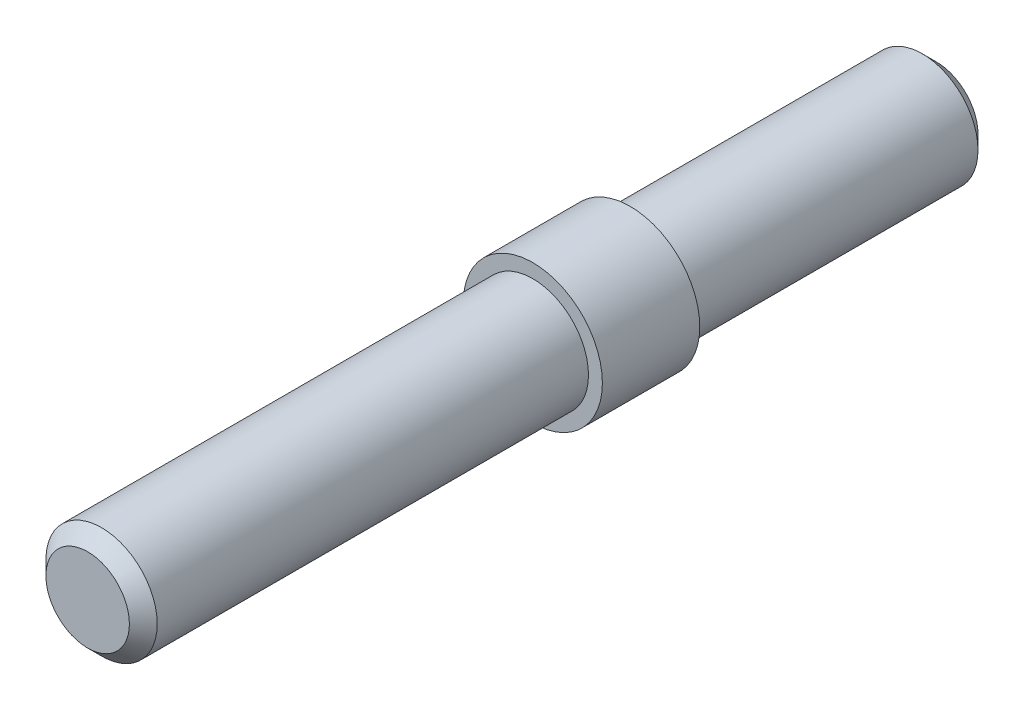
from build123d import *

# Parameters (mm, degrees)
EXTRUDE_1_DEPTH      = 45
EXTRUDE_1_DEPTH_BACK = 16
SKETCH_1_R           = 4
SKETCH_3_R           = 1.5
CUT_EXTRUDE_1_DEPTH  = 10
CHAMFER_1_SIZE       = 1
EXTRUDE_START        = -39
SKETCH_5_R           = 5
EXTRUDE_3_DEPTH      = 7
SKETCH_8_R           = 1.5
CUT_EXTRUDE_2_DEPTH  = 10
CHAMFER_2_SIZE       = 1


with BuildPart() as part:
    # 草图1 → 凸台-拉伸1 (new, two sides: drawn at the far end of the back side and taken through both)
    with BuildSketch(Plane.XY.offset(-EXTRUDE_1_DEPTH_BACK)):
        Circle(SKETCH_1_R)
    extrude(amount=EXTRUDE_1_DEPTH + EXTRUDE_1_DEPTH_BACK)

    # 草图3 → 切除-拉伸1 (cut)
    with BuildSketch(Plane(origin=(0, 0, 0), x_dir=(1, 0, 0), z_dir=(0, 1, 0))):
        with Locations((0, -17.5)):
            Circle(SKETCH_3_R)
    extrude(amount=-CUT_EXTRUDE_1_DEPTH, mode=Mode.SUBTRACT)

    # 倒角1
    chamfer_1_edges = [part.edges().sort_by_distance(p)[0] for p in [
        (-4, 0, 45),
    ]]
    chamfer(chamfer_1_edges, length=CHAMFER_1_SIZE)

    # 草图5 → 凸台-拉伸3 (add)
    with BuildSketch(Plane.XY.offset(45).offset(EXTRUDE_START)):
        Circle(SKETCH_5_R)
    extrude(amount=EXTRUDE_3_DEPTH)

    # 草图8 → 切除-拉伸2 (cut)
    with BuildSketch(Plane(origin=(0, 0, 0), x_dir=(1, 0, 0), z_dir=(0, 1, 0))):
        with Locations((0, 11)):
            Circle(SKETCH_8_R)
    extrude(amount=-CUT_EXTRUDE_2_DEPTH, mode=Mode.SUBTRACT)

    # 倒角2
    chamfer_2_edges = [part.edges().sort_by_distance(p)[0] for p in [
        (-4, 0, -16),
    ]]
    chamfer(chamfer_2_edges, length=CHAMFER_2_SIZE)


solid = part.part
